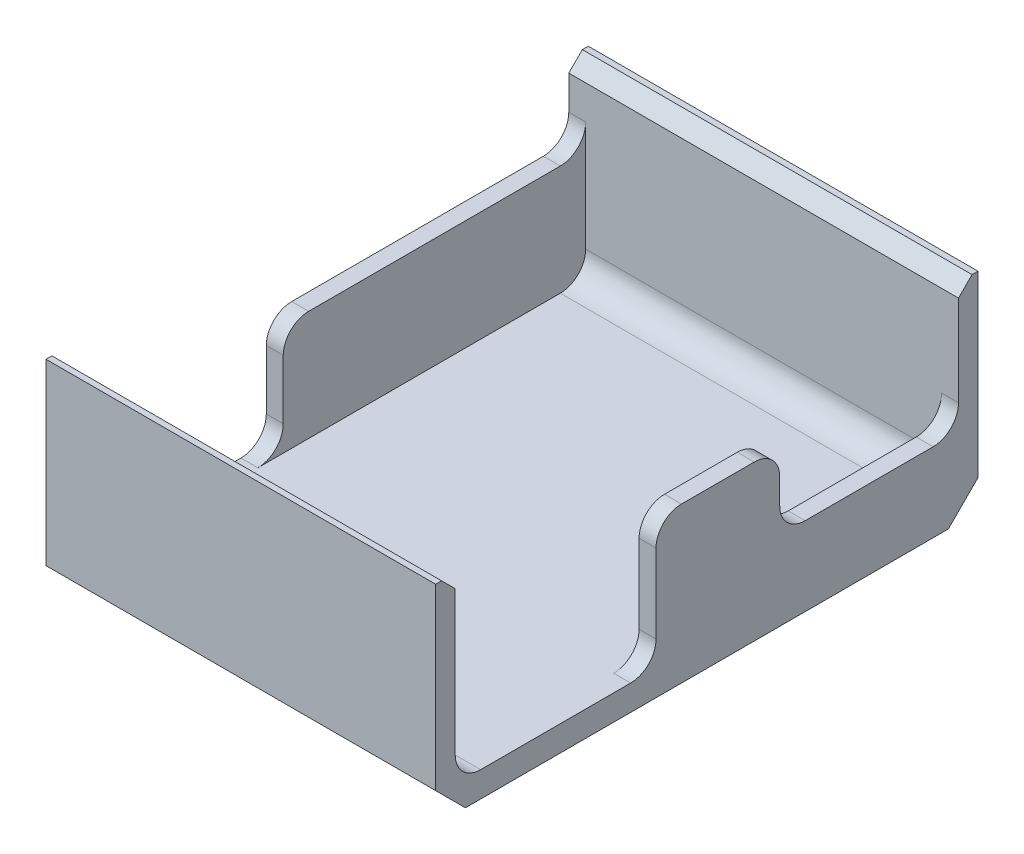
from build123d import *

# Parameters (mm, degrees)
SKETCH1_W           = 46
SKETCH1_H           = 64
BOSS_EXTRUDE1_DEPTH = 3
SKETCH2_W           = 46
SKETCH2_H           = 2.3
BOSS_EXTRUDE2_DEPTH = 22
SKETCH3_W           = 38
SKETCH3_H           = 16
BOSS_EXTRUDE3_DEPTH = 2
BOSS_EXTRUDE4_DEPTH = 2
FILLET1_R           = 3
SKETCH8_W           = 6
SKETCH8_H           = 1.076923077
BOSS_EXTRUDE5_DEPTH = 0.5
CHAMFER1_SIZE       = 2
SKETCH9_W           = 64
SKETCH9_H           = 0.4
CUT_EXTRUDE1_DEPTH  = 83.68615375
CHAMFER2_SIZE       = 3.5


with BuildPart() as part:
    # Sketch1 → Boss-Extrude1 (new body)
    with BuildSketch(Plane(origin=(0, 0, 0), x_dir=(1, 0, 0), z_dir=(0, 1, 0))):
        with Locations((23, 32)):
            Rectangle(SKETCH1_W, SKETCH1_H)
    extrude(amount=BOSS_EXTRUDE1_DEPTH)

    # Sketch2 → Boss-Extrude2 (add)
    with BuildSketch(Plane(origin=(0, 3, 0), x_dir=(1, 0, 0), z_dir=(0, 1, 0))):
        with Locations((23, 62.85)):
            Rectangle(SKETCH2_W, SKETCH2_H)
        with Locations((23, 1.15)):
            Rectangle(SKETCH2_W, SKETCH2_H)
    extrude(amount=BOSS_EXTRUDE2_DEPTH)

    # Sketch3 → Boss-Extrude3 (add)
    with BuildSketch(Plane.ZY):
        with Locations((-45, 8)):
            Rectangle(SKETCH3_W, SKETCH3_H)
    extrude(amount=-BOSS_EXTRUDE3_DEPTH)

    # Sketch5 → Boss-Extrude4 (add)
    with BuildSketch(Plane(origin=(46, 0, 0), x_dir=(0, 0, -1), z_dir=(1, 0, 0))):
        Polygon((64, 0), (26, 0), (26, 9.3), (26, 18.3), (40.6, 18.3), (40.6, 9.3), (64, 9.3), align=None)
    extrude(amount=-BOSS_EXTRUDE4_DEPTH)

    # Fillet1
    fillet1_edges = [part.edges().sort_by_distance(p)[0] for p in [
        (23, 3, -2.3),
        (23, 3, -61.7),
        (1, 16, -61.7),
        (1, 16, -26),
        (1, 3, -26),
        (45, 9.3, -61.7),
        (45, 9.3, -40.6),
        (45, 3, -26),
        (45, 18.3, -26),
        (45, 18.3, -40.6),
    ]]
    fillet(fillet1_edges, radius=FILLET1_R)

    # Sketch8 → Boss-Extrude5 (add)
    # profile 1 of 16: a face of its own
    with BuildSketch(Plane.XZ):
        Polygon((2.042970491, -35.976752262), (2.042970491, -34.977954185), (8.042970491, -32.554877262), (8.042970491, -33.705117646), (6.81220126, -34.1714638), (6.81220126, -36.785646493), (8.042970491, -37.251992646), (8.042970491, -38.401031108), align=None)
        Polygon((3.652345491, -35.477954185), (5.735278183, -36.376992646), (5.735278183, -34.578915723), align=None, mode=Mode.SUBTRACT)
    # profile 2 of 16: a face of its own
    with BuildSketch(Plane.XZ):
        Polygon((2.042970491, -31.670261877), (2.042970491, -30.700309954), (5.991287798, -27.977954185), (2.042970491, -27.977954185), (2.042970491, -26.901031108), (8.042970491, -26.901031108), (8.042970491, -27.878194569), (4.106672414, -30.5933388), (8.042970491, -30.5933388), (8.042970491, -31.670261877), align=None)
    # profile 3 of 16: a face of its own
    with BuildSketch(Plane.XZ):
        Polygon((2.042970491, -26.131800339), (2.042970491, -22.901031108), (3.119893568, -22.901031108), (3.119893568, -23.977954185), (8.042970491, -23.977954185), (8.042970491, -25.054877262), (3.119893568, -25.054877262), (3.119893568, -26.131800339), align=None)
    # profile 4 of 16: a face of its own
    with BuildSketch(Plane.XZ):
        Polygon((2.042970491, -22.054877262), (2.042970491, -18.824108031), (3.119893568, -18.824108031), (3.119893568, -20.977954185), (4.273739722, -20.977954185), (4.273739722, -18.824108031), (5.350662798, -18.824108031), (5.350662798, -20.977954185), (6.966047414, -20.977954185), (6.966047414, -18.824108031), (8.042970491, -18.824108031), (8.042970491, -22.054877262), align=None)
    # profile 5 of 16: a face of its own
    with BuildSketch(Plane.XZ):
        Polygon((2.042970491, -17.747184954), (2.042970491, -16.777233031), (5.991287798, -14.054877262), (2.042970491, -14.054877262), (2.042970491, -12.977954185), (8.042970491, -12.977954185), (8.042970491, -13.955117646), (4.106672414, -16.670261877), (8.042970491, -16.670261877), (8.042970491, -17.747184954), align=None)
    # profile 6 of 16: a face of its own
    with BuildSketch(Plane.XZ):
        Polygon((2.042970491, -9.745983031), (2.042970491, -8.747184954), (8.042970491, -6.324108031), (8.042970491, -7.474348416), (6.81220126, -7.940694569), (6.81220126, -10.554877262), (8.042970491, -11.021223416), (8.042970491, -12.170261877), align=None)
        Polygon((3.652345491, -9.247184954), (5.735278183, -10.146223416), (5.735278183, -8.348146493), align=None, mode=Mode.SUBTRACT)
    # profile 7 of 16: a face of its own
    with BuildSketch(Plane.XZ):
        with BuildLine():
            Line((35.538717626, -21.155652882), (35.538717626, -19.953729805))
            add(Edge.make_bspline(
                [(35.538717626, -19.953729805), (35.539069152, -19.87519771), (35.539747319, -19.723692837), (35.547971017, -19.505210354), (35.562708342, -19.303649538), (35.580921469, -19.119056818), (35.60645515, -18.9515077), (35.635728779, -18.800793641), (35.671388463, -18.666879252), (35.713729131, -18.548267678), (35.763603462, -18.441784791), (35.81687477, -18.341136035), (35.880019658, -18.247836243), (35.948486519, -18.159695001), (36.023699745, -18.077379052), (36.105362078, -18.000278422), (36.194660309, -17.929187031), (36.290979252, -17.864550576), (36.392357922, -17.805883138), (36.499027506, -17.754635867), (36.611143212, -17.713064775), (36.727983451, -17.678192409), (36.849542123, -17.650182421), (36.976567103, -17.631538121), (37.108171377, -17.618873964), (37.197741332, -17.617756527), (37.243044549, -17.617191344)],
                knots=[0, 0, 0, 0, 1.698787518, 3.27731721, 4.728409951, 6.070286353, 7.288646904, 8.393455548, 9.389990496, 10.283725379, 11.113616976, 11.931887102, 12.744353494, 13.547053751, 14.344590688, 15.153907614, 15.974148981, 16.810666655, 17.660988447, 18.506082349, 19.367288142, 20.244738011, 21.142497992, 22.06302001, 23.020302899, 24, 24, 24, 24], degree=3))
            add(Edge.make_bspline(
                [(37.243044549, -17.617191344), (37.293162419, -17.618009094), (37.391650192, -17.619616074), (37.536021189, -17.635369648), (37.673665846, -17.662281743), (37.805745027, -17.697454398), (37.930085439, -17.746500334), (38.049654977, -17.802532427), (38.161097268, -17.871471877), (38.265821346, -17.950238165), (38.364622562, -18.036289743), (38.454856397, -18.131530577), (38.536495899, -18.234838874), (38.613071551, -18.34334561), (38.678451961, -18.461521866), (38.739437735, -18.585230704), (38.791112761, -18.717586483), (38.818235659, -18.809681991), (38.831986857, -18.856374036)],
                knots=[0, 0, 0, 0, 1.101964615, 2.165495883, 3.188506962, 4.184641065, 5.166448333, 6.124117473, 7.085225874, 8.042124548, 9.003636759, 9.963451826, 10.9225791, 11.897800977, 12.880319672, 13.889154746, 14.929810112, 16, 16, 16, 16], degree=3))
            add(Edge.make_bspline(
                [(38.831986857, -18.856374036), (38.83963952, -18.887132129), (38.856217653, -18.953764063), (38.873048619, -19.064021613), (38.888523658, -19.191081862), (38.90182258, -19.33535568), (38.910862748, -19.496926244), (38.917922717, -19.675637112), (38.923056044, -19.871569271), (38.923238197, -20.007812747), (38.923333011, -20.078729805)],
                knots=[0, 0, 0, 0, 0.618981996, 1.340914327, 2.176866532, 3.120127938, 4.170906482, 5.338178032, 6.614476169, 8, 8, 8, 8], degree=3))
            Line((38.923333011, -20.078729805), (41.538717626, -20.078729805))
            Line((41.538717626, -20.078729805), (41.538717626, -21.155652882))
            Line((41.538717626, -21.155652882), (35.538717626, -21.155652882))
        make_face()
        with BuildLine():
            Line((37.846409934, -20.078729805), (37.846409934, -19.69772019))
            add(Edge.make_bspline(
                [(37.846409934, -19.69772019), (37.845970394, -19.628389393), (37.845161635, -19.500819696), (37.833463809, -19.326605683), (37.815602326, -19.186600614), (37.789975784, -19.07600284), (37.751110122, -18.988650186), (37.706071188, -18.91339943), (37.649204485, -18.848318797), (37.583129816, -18.793163489), (37.508697942, -18.748344918), (37.426108294, -18.7168403), (37.336538591, -18.6969735), (37.274002567, -18.6950854), (37.241842626, -18.694114421)],
                knots=[0, 0, 0, 0, 1.862197296, 3.426470689, 4.686743892, 5.65255712, 6.462325617, 7.244961981, 8.000258385, 8.771939908, 9.549006364, 10.32248703, 11.137317743, 12, 12, 12, 12], degree=3))
            add(Edge.make_bspline(
                [(37.241842626, -18.694114421), (37.213737455, -18.695054741), (37.159206665, -18.696879187), (37.080560564, -18.710466784), (37.007389965, -18.731555427), (36.940714846, -18.763785327), (36.87898007, -18.802915362), (36.824107456, -18.852556678), (36.77432169, -18.909803318), (36.748002482, -18.954074501), (36.734631088, -18.976566344)],
                knots=[0, 0, 0, 0, 1.102449765, 2.139017612, 3.12397484, 4.080535277, 5.035673127, 5.982361139, 6.974944601, 8, 8, 8, 8], degree=3))
            add(Edge.make_bspline(
                [(36.734631088, -18.976566344), (36.724998436, -18.995613418), (36.704604138, -19.035939978), (36.680894276, -19.10462002), (36.660892395, -19.183875739), (36.644291027, -19.274242201), (36.631406642, -19.375358908), (36.62155331, -19.48720782), (36.617590901, -19.609953532), (36.616308699, -19.69531583), (36.615640703, -19.739787498)],
                knots=[0, 0, 0, 0, 0.656809284, 1.390599849, 2.23162475, 3.173112763, 4.218524733, 5.370385145, 6.63003504, 8, 8, 8, 8], degree=3))
            Line((36.615640703, -19.739787498), (36.615640703, -20.078729805))
            Line((36.615640703, -20.078729805), (37.846409934, -20.078729805))
        make_face(mode=Mode.SUBTRACT)
    # profile 8 of 16: a face of its own
    with BuildSketch(Plane.XZ):
        with BuildLine():
            Line((36.579583011, -11.078729805), (37.334390703, -11.868393267))
            add(Edge.make_bspline(
                [(37.334390703, -11.868393267), (37.265115387, -11.935372716), (37.129798993, -12.066204565), (36.950850212, -12.277130438), (36.801093936, -12.495925274), (36.677500402, -12.720405815), (36.580221689, -12.951011401), (36.511434961, -13.18851543), (36.469030855, -13.432570867), (36.464216194, -13.59779165), (36.461794549, -13.680893267)],
                knots=[0, 0, 0, 0, 1.115315123, 2.178559852, 3.196385012, 4.180486591, 5.141138664, 6.08807191, 7.038351522, 8, 8, 8, 8], degree=3))
            add(Edge.make_bspline(
                [(36.461794549, -13.680893267), (36.463713389, -13.750290589), (36.467500007, -13.887238559), (36.495326548, -14.088295066), (36.542468305, -14.280688925), (36.607995005, -14.464572776), (36.690515092, -14.640855762), (36.794236892, -14.807896375), (36.915698564, -14.966592308), (37.054687566, -15.115089331), (37.207666931, -15.249150021), (37.368781626, -15.369940607), (37.54088138, -15.469990611), (37.72145645, -15.551661316), (37.910572043, -15.616019709), (38.108218692, -15.661697443), (38.31484265, -15.688163153), (38.455309175, -15.692109017), (38.526698395, -15.694114421)],
                knots=[0, 0, 0, 0, 1.035268443, 2.04298821, 3.02163646, 3.985902049, 4.951223231, 5.920091634, 6.913651787, 7.92868536, 8.949353712, 9.945284791, 10.92850487, 11.913014323, 12.897904816, 13.904240668, 14.934873455, 16, 16, 16, 16], degree=3))
            add(Edge.make_bspline(
                [(38.526698395, -15.694114421), (38.576802621, -15.693527499), (38.675559079, -15.692370663), (38.82127633, -15.680052614), (38.962945327, -15.659538967), (39.100225583, -15.630963316), (39.23329635, -15.5943317), (39.362469228, -15.55201587), (39.48620409, -15.497967753), (39.60681771, -15.438515537), (39.721406672, -15.370117629), (39.830046417, -15.29522171), (39.932761263, -15.214518021), (40.029185993, -15.126928754), (40.117932505, -15.031350969), (40.201417247, -14.930093017), (40.278323333, -14.822148977), (40.347426089, -14.707475587), (40.411837183, -14.589542988), (40.465175766, -14.465921628), (40.513124574, -14.340069427), (40.549196364, -14.209777582), (40.580571238, -14.077341427), (40.599732841, -13.940917505), (40.614293128, -13.801800549), (40.615189578, -13.707776698), (40.615640703, -13.660460575)],
                knots=[0, 0, 0, 0, 1.103738238, 2.175490744, 3.219137561, 4.256155604, 5.262629953, 6.259184223, 7.247888397, 8.234817694, 9.220364322, 10.185094651, 11.140491148, 12.096499151, 13.05201798, 14.011605636, 14.986460005, 15.968997565, 16.960259839, 17.944382265, 18.933125845, 19.924977513, 20.920749559, 21.929466621, 22.958034467, 24, 24, 24, 24], degree=3))
            add(Edge.make_bspline(
                [(40.615640703, -13.660460575), (40.613328044, -13.580201666), (40.608784272, -13.422513782), (40.572993176, -13.19113933), (40.514745532, -12.970307075), (40.443974087, -12.794500589), (40.375351135, -12.656682007), (40.313662166, -12.550882821), (40.242544609, -12.442638901), (40.161703152, -12.332115093), (40.071491035, -12.218669898), (39.970145543, -12.10418068), (39.860942457, -11.985753181), (39.783004687, -11.908171058), (39.743044549, -11.868393267)],
                knots=[0, 0, 0, 0, 1.404693586, 2.759857621, 4.088769373, 5.395275838, 6.0697462, 6.783214465, 7.53810233, 8.336454657, 9.18000028, 10.074808326, 11.012918585, 12, 12, 12, 12], degree=3))
            Line((39.743044549, -11.868393267), (40.547131088, -11.102768267))
            add(Edge.make_bspline(
                [(40.547131088, -11.102768267), (40.599091948, -11.156587583), (40.700508435, -11.261631379), (40.844510384, -11.42008703), (40.973912143, -11.578343257), (41.093410428, -11.732576922), (41.199523966, -11.88531453), (41.292358732, -12.036539887), (41.374262652, -12.184541053), (41.443854457, -12.332391321), (41.502945127, -12.481010691), (41.553818315, -12.633922558), (41.596855202, -12.791594388), (41.631580318, -12.954989168), (41.659425173, -13.12258285), (41.678220289, -13.295943891), (41.690855621, -13.473973094), (41.69199101, -13.59473306), (41.69256378, -13.655652882)],
                knots=[0, 0, 0, 0, 1.244526981, 2.429050516, 3.560637417, 4.644440555, 5.67424972, 6.652764056, 7.595344123, 8.486817594, 9.369275933, 10.254498637, 11.166417451, 12.086725134, 13.032340136, 13.991389299, 14.986715468, 16, 16, 16, 16], degree=3))
            add(Edge.make_bspline(
                [(41.69256378, -13.655652882), (41.689711171, -13.767555049), (41.684129407, -13.986516484), (41.642772317, -14.307398759), (41.573437885, -14.612228306), (41.475379875, -14.901746719), (41.350115361, -15.175861937), (41.19654695, -15.434503835), (41.015082648, -15.677255538), (40.807849393, -15.902156091), (40.578977659, -16.105589344), (40.333232206, -16.285400781), (40.069405285, -16.434140809), (39.791394461, -16.557642859), (39.497931064, -16.654219838), (39.188697656, -16.722193658), (38.863992821, -16.764112617), (38.642211933, -16.768698611), (38.529102241, -16.771037498)],
                knots=[0, 0, 0, 0, 1.078019885, 2.10938526, 3.111377082, 4.085535484, 5.04941344, 6.010039228, 6.978205633, 7.964457913, 8.951525778, 9.924444315, 10.892603023, 11.863865945, 12.85144698, 13.863884204, 14.910567087, 16, 16, 16, 16], degree=3))
            add(Edge.make_bspline(
                [(38.529102241, -16.771037498), (38.455331295, -16.770058939), (38.309135308, -16.768119676), (38.09341263, -16.747355692), (37.883385104, -16.719152706), (37.680847491, -16.672823588), (37.48349438, -16.618963939), (37.293072232, -16.549573771), (37.108778916, -16.46895614), (36.930847194, -16.376905772), (36.761198492, -16.27147592), (36.598750902, -16.156690833), (36.445608761, -16.029766671), (36.301140683, -15.89198807), (36.163710318, -15.744628216), (36.036697535, -15.58516338), (35.916694882, -15.416313173), (35.807281305, -15.236907941), (35.70777154, -15.051035785), (35.622160637, -14.859599879), (35.548703347, -14.665068132), (35.488225689, -14.466850696), (35.442960115, -14.264597079), (35.408728849, -14.059662509), (35.389586124, -13.850326965), (35.386453035, -13.709775431), (35.384871472, -13.638825959)],
                knots=[0, 0, 0, 0, 1.071814294, 2.12407397, 3.147667899, 4.14936388, 5.141177959, 6.119239245, 7.091825145, 8.063277363, 9.028022524, 9.992609517, 10.952139039, 11.915934802, 12.892469547, 13.878248468, 14.87668965, 15.901326483, 16.93027266, 17.938917451, 18.9468897, 19.950817235, 20.948103127, 21.957084021, 22.968749718, 24, 24, 24, 24], degree=3))
            add(Edge.make_bspline(
                [(35.384871472, -13.638825959), (35.385779003, -13.578299126), (35.387584629, -13.457874769), (35.402609883, -13.278537751), (35.42627389, -13.100654619), (35.461728344, -12.924768571), (35.50466532, -12.750088658), (35.557552083, -12.577346218), (35.622061539, -12.407017594), (35.69342261, -12.237626171), (35.774663485, -12.072550209), (35.865596725, -11.91322433), (35.963843431, -11.759253753), (36.07109346, -11.611566663), (36.18577145, -11.469122839), (36.307873603, -11.332074264), (36.439614824, -11.201736024), (36.532691083, -11.119939161), (36.579583011, -11.078729805)],
                knots=[0, 0, 0, 0, 0.996333415, 1.982307736, 2.96084097, 3.949129141, 4.93457382, 5.921430247, 6.92116383, 7.931890485, 8.946633814, 9.948019707, 10.950686436, 11.952094051, 12.951305284, 13.960287133, 14.972390273, 16, 16, 16, 16], degree=3))
        make_face()
    # profile 9 of 16: a face of its own
    with BuildSketch(Plane.XZ):
        with Locations((38.538717626, -58.039332271)):
            Rectangle(SKETCH8_W, SKETCH8_H)
    # profile 10 of 16: a face of its own
    with BuildSketch(Plane.XZ):
        Polygon((35.538717626, -56.116255347), (35.538717626, -55.146303424), (39.487034934, -52.423947655), (35.538717626, -52.423947655), (35.538717626, -51.347024578), (41.538717626, -51.347024578), (41.538717626, -52.324188039), (37.602419549, -55.03933227), (41.538717626, -55.03933227), (41.538717626, -56.116255347), align=None)
    # profile 11 of 16: a face of its own
    with BuildSketch(Plane.XZ):
        with BuildLine():
            Line((35.538717626, -49.962409193), (35.538717626, -48.760486116))
            add(Edge.make_bspline(
                [(35.538717626, -48.760486116), (35.539069152, -48.681954021), (35.539747319, -48.530449148), (35.547971017, -48.311966665), (35.562708342, -48.110405849), (35.580921469, -47.925813129), (35.60645515, -47.758264011), (35.635728779, -47.607549952), (35.671388463, -47.473635563), (35.713729131, -47.355023989), (35.763603462, -47.248541102), (35.81687477, -47.147892346), (35.880019658, -47.054592554), (35.948486519, -46.966451312), (36.023699745, -46.884135363), (36.105362078, -46.807034733), (36.194660309, -46.735943342), (36.290979252, -46.671306887), (36.392357922, -46.612639449), (36.499027506, -46.561392178), (36.611143212, -46.519821086), (36.727983451, -46.48494872), (36.849542123, -46.456938732), (36.976567103, -46.438294432), (37.108171377, -46.425630275), (37.197741332, -46.424512838), (37.243044549, -46.423947655)],
                knots=[0, 0, 0, 0, 1.698787518, 3.27731721, 4.728409951, 6.070286353, 7.288646904, 8.393455548, 9.389990496, 10.283725379, 11.113616976, 11.931887102, 12.744353494, 13.547053751, 14.344590688, 15.153907614, 15.974148981, 16.810666655, 17.660988447, 18.506082349, 19.367288142, 20.244738011, 21.142497992, 22.06302001, 23.020302899, 24, 24, 24, 24], degree=3))
            add(Edge.make_bspline(
                [(37.243044549, -46.423947655), (37.293162419, -46.424765405), (37.391650192, -46.426372385), (37.536021189, -46.442125959), (37.673665846, -46.469038054), (37.805745027, -46.504210709), (37.930085439, -46.553256645), (38.049654977, -46.609288738), (38.161097268, -46.678228188), (38.265821346, -46.756994476), (38.364622562, -46.843046054), (38.454856397, -46.938286888), (38.536495899, -47.041595185), (38.613071551, -47.150101921), (38.678451961, -47.268278177), (38.739437735, -47.391987015), (38.791112761, -47.524342794), (38.818235659, -47.616438302), (38.831986857, -47.663130347)],
                knots=[0, 0, 0, 0, 1.101964615, 2.165495883, 3.188506962, 4.184641065, 5.166448333, 6.124117473, 7.085225874, 8.042124548, 9.003636759, 9.963451826, 10.9225791, 11.897800977, 12.880319672, 13.889154746, 14.929810112, 16, 16, 16, 16], degree=3))
            add(Edge.make_bspline(
                [(38.831986857, -47.663130347), (38.83963952, -47.69388844), (38.856217653, -47.760520374), (38.873048619, -47.870777924), (38.888523658, -47.997838173), (38.90182258, -48.142111991), (38.910862748, -48.303682555), (38.917922717, -48.482393423), (38.923056044, -48.678325582), (38.923238197, -48.814569058), (38.923333011, -48.885486116)],
                knots=[0, 0, 0, 0, 0.618981996, 1.340914327, 2.176866532, 3.120127938, 4.170906482, 5.338178032, 6.614476169, 8, 8, 8, 8], degree=3))
            Line((38.923333011, -48.885486116), (41.538717626, -48.885486116))
            Line((41.538717626, -48.885486116), (41.538717626, -49.962409193))
            Line((41.538717626, -49.962409193), (35.538717626, -49.962409193))
        make_face()
        with BuildLine():
            Line((37.846409934, -48.885486116), (37.846409934, -48.504476501))
            add(Edge.make_bspline(
                [(37.846409934, -48.504476501), (37.845970394, -48.435145704), (37.845161635, -48.307576007), (37.833463809, -48.133361994), (37.815602326, -47.993356925), (37.789975784, -47.882759151), (37.751110122, -47.795406497), (37.706071188, -47.720155741), (37.649204485, -47.655075108), (37.583129816, -47.5999198), (37.508697942, -47.555101229), (37.426108294, -47.523596611), (37.336538591, -47.503729811), (37.274002567, -47.501841711), (37.241842626, -47.500870732)],
                knots=[0, 0, 0, 0, 1.862197296, 3.426470689, 4.686743892, 5.65255712, 6.462325617, 7.244961981, 8.000258385, 8.771939908, 9.549006364, 10.32248703, 11.137317743, 12, 12, 12, 12], degree=3))
            add(Edge.make_bspline(
                [(37.241842626, -47.500870732), (37.213737455, -47.501811052), (37.159206665, -47.503635498), (37.080560564, -47.517223095), (37.007389965, -47.538311738), (36.940714846, -47.570541638), (36.87898007, -47.609671673), (36.824107456, -47.659312989), (36.77432169, -47.716559629), (36.748002482, -47.760830812), (36.734631088, -47.783322655)],
                knots=[0, 0, 0, 0, 1.102449765, 2.139017612, 3.12397484, 4.080535277, 5.035673127, 5.982361139, 6.974944601, 8, 8, 8, 8], degree=3))
            add(Edge.make_bspline(
                [(36.734631088, -47.783322655), (36.724998436, -47.802369729), (36.704604138, -47.842696289), (36.680894276, -47.911376331), (36.660892395, -47.99063205), (36.644291027, -48.080998512), (36.631406642, -48.182115219), (36.62155331, -48.293964131), (36.617590901, -48.416709843), (36.616308699, -48.502072141), (36.615640703, -48.546543809)],
                knots=[0, 0, 0, 0, 0.656809284, 1.390599849, 2.23162475, 3.173112763, 4.218524733, 5.370385145, 6.63003504, 8, 8, 8, 8], degree=3))
            Line((36.615640703, -48.546543809), (36.615640703, -48.885486116))
            Line((36.615640703, -48.885486116), (37.846409934, -48.885486116))
        make_face(mode=Mode.SUBTRACT)
    # profile 12 of 16: a face of its own
    with BuildSketch(Plane.XZ):
        with BuildLine():
            Line((35.538717626, -45.270101501), (35.538717626, -44.193178424))
            Line((35.538717626, -44.193178424), (39.44256378, -44.193178424))
            add(Edge.make_bspline(
                [(39.44256378, -44.193178424), (39.483036884, -44.193117485), (39.561210267, -44.192999782), (39.673367967, -44.187369427), (39.776846682, -44.182062889), (39.870807635, -44.173033983), (39.955542499, -44.158871507), (40.031363462, -44.145648843), (40.097594822, -44.127520326), (40.173035038, -44.100372788), (40.257784033, -44.057989347), (40.347112953, -43.990765465), (40.426623232, -43.910488765), (40.493383772, -43.81595068), (40.549850605, -43.710402194), (40.587198686, -43.591763243), (40.612531218, -43.463890605), (40.614584823, -43.374801644), (40.615640703, -43.328995732)],
                knots=[0, 0, 0, 0, 1.155195489, 2.231248153, 3.20507519, 4.113220553, 4.92363642, 5.657123012, 6.309133385, 6.880755525, 7.944644177, 8.999147208, 10.058600405, 11.156792429, 12.29246015, 13.460660758, 14.694375292, 16, 16, 16, 16], degree=3))
            add(Edge.make_bspline(
                [(40.615640703, -43.328995732), (40.614222218, -43.280385382), (40.611456412, -43.185603429), (40.584307033, -43.049274678), (40.541075922, -42.922965321), (40.479374112, -42.80934974), (40.405413673, -42.708541061), (40.321075615, -42.623208475), (40.226191641, -42.555864837), (40.138654159, -42.511971116), (40.058083006, -42.487330856), (39.986097551, -42.468847019), (39.901546235, -42.455425436), (39.805016309, -42.44286007), (39.695804452, -42.435736269), (39.574481551, -42.427623353), (39.44097379, -42.424713993), (39.348011763, -42.42421031), (39.299534934, -42.423947655)],
                knots=[0, 0, 0, 0, 1.26131785, 2.459356261, 3.594833267, 4.716926138, 5.803419038, 6.833631221, 7.818372604, 8.814377287, 9.360705024, 10.004324776, 10.743421339, 11.582437492, 12.532246195, 13.585177397, 14.740744533, 16, 16, 16, 16], degree=3))
            Line((39.299534934, -42.423947655), (35.538717626, -42.423947655))
            Line((35.538717626, -42.423947655), (35.538717626, -41.347024578))
            Line((35.538717626, -41.347024578), (39.118044549, -41.347024578))
            add(Edge.make_bspline(
                [(39.118044549, -41.347024578), (39.190561542, -41.347174128), (39.330004646, -41.347461699), (39.530394199, -41.351877918), (39.713417912, -41.361279251), (39.879129264, -41.369175285), (40.027305013, -41.384456817), (40.158577919, -41.400376584), (40.272482753, -41.420667712), (40.402149649, -41.450859631), (40.551455793, -41.502962324), (40.723377859, -41.586956899), (40.89169017, -41.693589416), (41.054589865, -41.819597122), (41.205772779, -41.961971445), (41.338869286, -42.116936747), (41.449614636, -42.283782158), (41.539157327, -42.461737009), (41.608104657, -42.65267916), (41.656838387, -42.857058951), (41.687849009, -43.076045159), (41.690960688, -43.227123738), (41.69256378, -43.30495727)],
                knots=[0, 0, 0, 0, 1.170930413, 2.251584989, 3.235934929, 4.130173708, 4.929654547, 5.640582214, 6.264911921, 6.796838084, 7.789064304, 8.810388137, 9.880124863, 11.000704429, 12.131026409, 13.227749078, 14.29171941, 15.356377855, 16.43689688, 17.561893293, 18.743922147, 20, 20, 20, 20], degree=3))
            add(Edge.make_bspline(
                [(41.69256378, -43.30495727), (41.691690109, -43.356677394), (41.689966373, -43.458720138), (41.674846904, -43.608804868), (41.65238326, -43.753841578), (41.620246634, -43.893907205), (41.576377898, -44.028518776), (41.524535747, -44.158547534), (41.465218486, -44.284464498), (41.393230213, -44.402334592), (41.317614812, -44.515053482), (41.234879881, -44.618839653), (41.148694344, -44.715288871), (41.057085473, -44.803280862), (40.960705848, -44.882897869), (40.859461127, -44.954078019), (40.75332771, -45.016688415), (40.640401402, -45.072312573), (40.514939368, -45.119916459), (40.372483216, -45.160068448), (40.211171065, -45.194973458), (40.029940225, -45.221396687), (39.829615867, -45.244685475), (39.609433505, -45.259775653), (39.370105588, -45.267564799), (39.204187937, -45.269234568), (39.118044549, -45.270101501)],
                knots=[0, 0, 0, 0, 1.001237316, 1.975420686, 2.917953599, 3.841913885, 4.754568974, 5.656377887, 6.55158913, 7.445656762, 8.327865759, 9.178398172, 10.013362476, 10.830881591, 11.635451955, 12.431789376, 13.224756564, 14.019278107, 14.866442763, 15.819105778, 16.882716987, 18.059987251, 19.363897986, 20.787153213, 22.331910422, 24, 24, 24, 24], degree=3))
            Line((39.118044549, -45.270101501), (35.538717626, -45.270101501))
        make_face()
    # profile 13 of 16: a face of its own
    with BuildSketch(Plane.XZ):
        Polygon((35.538717626, -40.577793809), (35.538717626, -37.347024578), (36.615640703, -37.347024578), (36.615640703, -38.423947655), (41.538717626, -38.423947655), (41.538717626, -39.500870732), (36.615640703, -39.500870732), (36.615640703, -40.577793809), align=None)
    # profile 14 of 16: a face of its own
    with BuildSketch(Plane.XZ):
        with BuildLine():
            Line((4.042970491, -57.731639963), (4.042970491, -58.808563039))
            add(Edge.make_bspline(
                [(4.042970491, -58.808563039), (3.961506105, -58.8039138), (3.802329586, -58.794829465), (3.571134892, -58.758654642), (3.352627877, -58.710306174), (3.147465458, -58.64522794), (2.955561442, -58.565069496), (2.7775515, -58.467835791), (2.612160106, -58.356429877), (2.462287896, -58.228606156), (2.327548221, -58.089552377), (2.209755261, -57.939625026), (2.111147149, -57.77924999), (2.030258464, -57.609499662), (1.965537098, -57.431040801), (1.922288408, -57.242070334), (1.892993635, -57.044255676), (1.890430639, -56.908834323), (1.889124337, -56.839813039)],
                knots=[0, 0, 0, 0, 1.198928049, 2.342633425, 3.435730849, 4.486331048, 5.502589352, 6.488331875, 7.46361919, 8.428949135, 9.378681775, 10.305958057, 11.226249248, 12.140413166, 13.066341608, 14.010670971, 14.986082777, 16, 16, 16, 16], degree=3))
            add(Edge.make_bspline(
                [(1.889124337, -56.839813039), (1.891590197, -56.755052347), (1.896406248, -56.589506906), (1.94291791, -56.349755809), (2.0141429, -56.124643231), (2.117622986, -55.91656373), (2.248112209, -55.72587908), (2.404002135, -55.553649423), (2.58718656, -55.403233785), (2.792390239, -55.275805236), (3.010106029, -55.17042854), (3.234822028, -55.095876236), (3.460738418, -55.047132006), (3.612841073, -55.041921008), (3.688403183, -55.03933227)],
                knots=[0, 0, 0, 0, 1.075374184, 2.100304875, 3.089917907, 4.066149699, 5.039978333, 6.01615708, 7.006437042, 8.039858286, 9.077679641, 10.07047942, 11.041445745, 12, 12, 12, 12], degree=3))
            add(Edge.make_bspline(
                [(3.688403183, -55.03933227), (3.734109369, -55.040338896), (3.826104632, -55.042364984), (3.965316044, -55.056452641), (4.10711914, -55.077586917), (4.251392354, -55.10945223), (4.398176055, -55.14919098), (4.547909811, -55.197399468), (4.699743525, -55.255197645), (4.855390637, -55.3216143), (5.015338121, -55.400871903), (5.182059353, -55.493064388), (5.355376846, -55.601273961), (5.536990602, -55.721978073), (5.724127587, -55.859925255), (5.918865809, -56.011461416), (6.120898416, -56.177349351), (6.256007055, -56.294994814), (6.325422414, -56.355438039)],
                knots=[0, 0, 0, 0, 0.728277616, 1.465842947, 2.227925269, 3.011838508, 3.818735656, 4.650581052, 5.517389122, 6.406849312, 7.346234817, 8.360743166, 9.441530624, 10.601362564, 11.834937575, 13.145232671, 14.533293658, 16, 16, 16, 16], degree=3))
            Line((6.325422414, -56.355438039), (7.042970491, -56.981639963))
            Line((7.042970491, -56.981639963), (7.042970491, -54.962409193))
            Line((7.042970491, -54.962409193), (8.042970491, -54.962409193))
            Line((8.042970491, -54.962409193), (8.042970491, -58.962409193))
            Line((8.042970491, -58.962409193), (7.497297414, -58.962409193))
            Line((7.497297414, -58.962409193), (5.606672414, -57.185966886))
            add(Edge.make_bspline(
                [(5.606672414, -57.185966886), (5.551522844, -57.134533501), (5.444714483, -57.034922289), (5.287846079, -56.893199026), (5.139013841, -56.764904794), (4.996491807, -56.652908234), (4.865105587, -56.550433234), (4.739888281, -56.464705359), (4.624366228, -56.390046883), (4.483549441, -56.312058218), (4.316868839, -56.236290167), (4.124964632, -56.166812072), (3.94141979, -56.124884899), (3.821603902, -56.119053066), (3.764124337, -56.116255347)],
                knots=[0, 0, 0, 0, 1.246192343, 2.413505005, 3.49357156, 4.492416076, 5.408771964, 6.246246772, 6.999304986, 7.680960093, 8.904522682, 10.020616941, 11.0504258, 12, 12, 12, 12], degree=3))
            add(Edge.make_bspline(
                [(3.764124337, -56.116255347), (3.708515306, -56.118341614), (3.600763892, -56.122384091), (3.447488081, -56.166807634), (3.30871248, -56.235630127), (3.188583861, -56.33261074), (3.08986621, -56.450084636), (3.016442794, -56.585836757), (2.97407782, -56.738760326), (2.968775238, -56.84596266), (2.966047414, -56.901111116)],
                knots=[0, 0, 0, 0, 1.062038974, 2.057870785, 3.028805853, 4.01125022, 4.991535629, 5.949134679, 6.94496649, 8, 8, 8, 8], degree=3))
            add(Edge.make_bspline(
                [(2.966047414, -56.901111116), (2.967055105, -56.929601511), (2.969038907, -56.985689429), (2.982244538, -57.068134283), (3.005518085, -57.146586486), (3.036701362, -57.221919253), (3.07803502, -57.293328613), (3.128985339, -57.36063445), (3.188257555, -57.424545915), (3.255666332, -57.484769884), (3.330894547, -57.539581558), (3.413255144, -57.588265087), (3.502697, -57.628518261), (3.598039344, -57.663958618), (3.700306233, -57.691291917), (3.808885609, -57.71119395), (3.923600829, -57.726324136), (4.002456755, -57.729835786), (4.042970491, -57.731639963)],
                knots=[0, 0, 0, 0, 0.903469896, 1.778625579, 2.63899355, 3.493148037, 4.358286772, 5.247621495, 6.164656832, 7.118446693, 8.109501108, 9.111810964, 10.146451449, 11.215617525, 12.33435995, 13.498009769, 14.714554818, 16, 16, 16, 16], degree=3))
        make_face()
    # profile 15 of 16: a face of its own
    with BuildSketch(Plane.XZ):
        Polygon((1.889124337, -51.777313039), (1.889124337, -50.654716886), (5.81220126, -50.654716886), (5.81220126, -50.116255347), (6.81220126, -50.116255347), (6.81220126, -50.654716886), (8.042970491, -50.654716886), (8.042970491, -51.731639963), (6.81220126, -51.731639963), (6.81220126, -54.270101501), (5.722057029, -54.270101501), align=None)
        Polygon((5.81220126, -51.731639963), (3.770133952, -51.731639963), (5.81220126, -53.059764963), align=None, mode=Mode.SUBTRACT)
    # profile 16 of 16: a face of its own
    with BuildSketch(Plane.XZ):
        Polygon((2.042970491, -49.53933227), (2.042970491, -48.389091886), (6.304989722, -46.847024578), (2.042970491, -45.301351501), (2.042970491, -44.154716886), (8.042970491, -46.330197655), (8.042970491, -47.36745727), align=None)
    extrude(amount=BOSS_EXTRUDE5_DEPTH)

    # Chamfer1
    chamfer1_edges = [part.edges().sort_by_distance(p)[0] for p in [
        (23, 25, -61.7),
        (23, 25, -2.3),
    ]]
    chamfer(chamfer1_edges, length=CHAMFER1_SIZE)

    # Sketch9 → Cut-Extrude1 (cut, through all)
    with BuildSketch(Plane.ZY):
        with Locations((-32, 24.8)):
            Rectangle(SKETCH9_W, SKETCH9_H)
    extrude(amount=-CUT_EXTRUDE1_DEPTH, mode=Mode.SUBTRACT)

    # Chamfer2
    chamfer2_edges = [part.edges().sort_by_distance(p)[0] for p in [
        (23, 0, -64),
        (23, 0, 0),
    ]]
    chamfer(chamfer2_edges, length=CHAMFER2_SIZE)


solid = part.part
